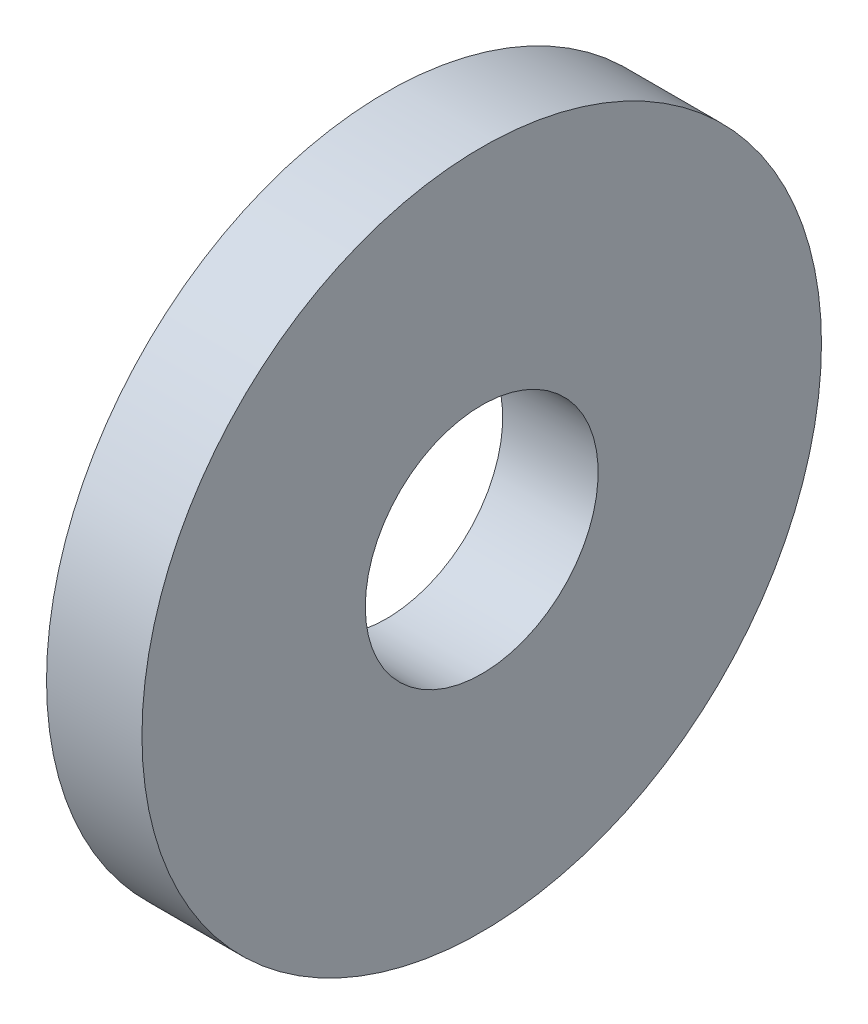
from build123d import *

# Parameters (mm, degrees)
SKETCH1_W = 2.5
SKETCH1_H = 5.85


with BuildPart() as part:
    # Sketch1 → Revolve1 (revolve)
    with BuildSketch(Plane.XY, mode=Mode.PRIVATE) as revolve1_sk:
        with Locations((-1.25, 5.975)):
            Rectangle(SKETCH1_W, SKETCH1_H)
    revolve(revolve1_sk.sketch.rotate(Axis((-10, 0, 0), (1, 0, 0)), 90), axis=Axis((-10, 0, 0), (1, 0, 0)))


solid = part.part
